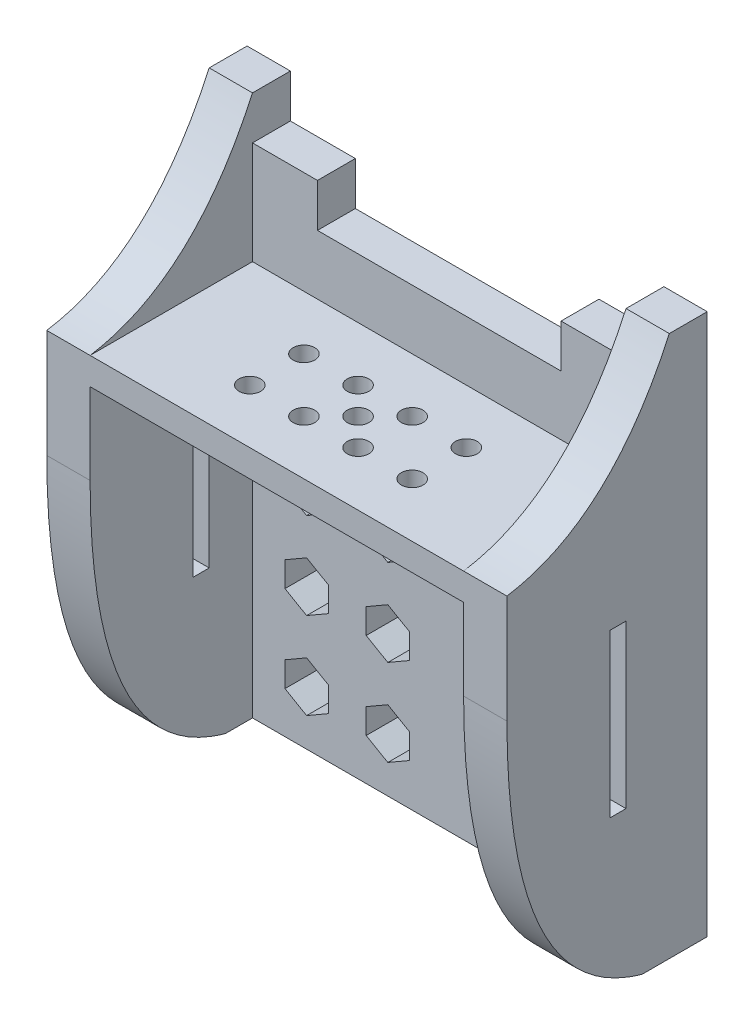
from build123d import *

# Parameters (mm, degrees)
SALIENTE_EXTRUIR1_DEPTH = 7
SALIENTE_EXTRUIR2_DEPTH = 30
CORTAR_EXTRUIR3_REACH   = 108.292
CROQUIS3_W              = 3
CROQUIS3_H              = 30
CORTAR_EXTRUIR4_DEPTH   = 7
CROQUIS5_R              = 2
CORTAR_EXTRUIR5_DEPTH   = 5


with BuildPart() as part:
    # Croquis1 → Saliente-Extruir1 (new body)
    with BuildSketch(Plane.XY):
        Polygon((-42.5, 52), (-34.5, 52), (-34.5, 44), (-22.5, 44), (-22.5, 36), (22.5, 36), (22.5, 44), (34.5, 44), (34.5, 52), (42.5, 52), (42.5, -48), (-42.5, -48), align=None)
    extrude(amount=SALIENTE_EXTRUIR1_DEPTH)

    # Croquis2 → Saliente-Extruir2 (add)
    with BuildSketch(Plane.XY.offset(7)):
        Polygon((-42.5, 52), (-42.5, -48), (-34.5, -48), (-34.5, 20), (34.5, 20), (34.5, -48), (42.5, -48), (42.5, 52), (34.5, 52), (34.5, 25), (-34.5, 25), (-34.5, 52), align=None)
    extrude(amount=SALIENTE_EXTRUIR2_DEPTH)

    # Cortar-Extruir3: up to this face of the body (flat: up to its plane)
    cortar_extruir3_end = Plane(part.part.faces().sort_by_distance((42.5, 2, 18.5))[0])
    # Croquis3 → Cortar-Extruir3 (cut, up to the picked face)
    with BuildSketch(Plane.ZY.offset(42.5), mode=Mode.PRIVATE) as cortar_extruir3_sk1:
        with BuildLine():
            Line((37, 52), (7, 52))
            add(Edge.make_bspline(
                [(7, 52), (17.9721482, 28.003586462), (37, 25)],
                knots=[0, 0, 0, 0.777512114, 0.777512114, 0.777512114], degree=2))
            Line((37, 25), (37, 52))
        make_face()
    cortar_extruir3_tool1 = split(extrude(cortar_extruir3_sk1.sketch, amount=-CORTAR_EXTRUIR3_REACH, mode=Mode.PRIVATE), bisect_by=cortar_extruir3_end, keep=Keep.BOTH, mode=Mode.PRIVATE)
    # Croquis3 → Cortar-Extruir3 (cut, up to the picked face)
    with BuildSketch(Plane.ZY.offset(42.5), mode=Mode.PRIVATE) as cortar_extruir3_sk2:
        with BuildLine():
            Line((37, -48), (37, 5))
            add(Edge.make_bspline(
                [(37, 5), (36.935096366, -41.11468491), (12, -48)],
                knots=[0, 0, 0, 0.740176789, 0.740176789, 0.740176789], degree=2))
            Line((12, -48), (37, -48))
        make_face()
    cortar_extruir3_tool2 = split(extrude(cortar_extruir3_sk2.sketch, amount=-CORTAR_EXTRUIR3_REACH, mode=Mode.PRIVATE), bisect_by=cortar_extruir3_end, keep=Keep.BOTH, mode=Mode.PRIVATE)
    # Croquis3 → Cortar-Extruir3 (cut, up to the picked face)
    with BuildSketch(Plane.ZY.offset(42.5), mode=Mode.PRIVATE) as cortar_extruir3_sk3:
        with Locations((16.5, -5)):
            Rectangle(CROQUIS3_W, CROQUIS3_H)
    cortar_extruir3_tool3 = split(extrude(cortar_extruir3_sk3.sketch, amount=-CORTAR_EXTRUIR3_REACH, mode=Mode.PRIVATE), bisect_by=cortar_extruir3_end, keep=Keep.BOTH, mode=Mode.PRIVATE)
    add(cortar_extruir3_tool1.solids().sort_by(Axis((-42.5, 41.293865, 25.499066), (1, 0, 0)))[0], mode=Mode.SUBTRACT)
    add(cortar_extruir3_tool2.solids().sort_by(Axis((-42.5, -37.068003, 30.970324), (1, 0, 0)))[0], mode=Mode.SUBTRACT)
    add(cortar_extruir3_tool3.solids().sort_by(Axis((-42.5, -5, 16.5), (1, 0, 0)))[0], mode=Mode.SUBTRACT)

    # Croquis4 → Cortar-Extruir4 (cut)
    with BuildSketch(Plane.XY.offset(7)):
        Polygon((-13.5, 12.309401077), (-13.5, 7.690598923), (-9.5, 5.381197846), (-5.5, 7.690598923), (-5.5, 12.309401077), (-9.5, 14.618802154), align=None)
        Polygon((-24.5, -10.618802154), (-20.5, -8.309401077), (-20.5, -3.690598923), (-24.5, -1.381197846), (-28.5, -3.690598923), (-28.5, -8.309401077), align=None)
        Polygon((-24.5, 5.381197846), (-20.5, 7.690598923), (-20.5, 12.309401077), (-24.5, 14.618802154), (-28.5, 12.309401077), (-28.5, 7.690598923), align=None)
        Polygon((-24.5, -26.618802154), (-20.5, -24.309401077), (-20.5, -19.690598923), (-24.5, -17.381197846), (-28.5, -19.690598923), (-28.5, -24.309401077), align=None)
        Polygon((-24.5, -42.618802154), (-20.5, -40.309401077), (-20.5, -35.690598923), (-24.5, -33.381197846), (-28.5, -35.690598923), (-28.5, -40.309401077), align=None)
        Polygon((-9.5, -10.618802154), (-5.5, -8.309401077), (-5.5, -3.690598923), (-9.5, -1.381197846), (-13.5, -3.690598923), (-13.5, -8.309401077), align=None)
        Polygon((-9.5, -26.618802154), (-5.5, -24.309401077), (-5.5, -19.690598923), (-9.5, -17.381197846), (-13.5, -19.690598923), (-13.5, -24.309401077), align=None)
        Polygon((-9.5, -42.618802154), (-5.5, -40.309401077), (-5.5, -35.690598923), (-9.5, -33.381197846), (-13.5, -35.690598923), (-13.5, -40.309401077), align=None)
        Polygon((13.5, -40.309401077), (9.5, -42.618802154), (5.5, -40.309401077), (5.5, -35.690598923), (9.5, -33.381197846), (13.5, -35.690598923), align=None)
        Polygon((28.5, -40.309401077), (24.5, -42.618802154), (20.5, -40.309401077), (20.5, -35.690598923), (24.5, -33.381197846), (28.5, -35.690598923), align=None)
        Polygon((28.5, -24.309401077), (24.5, -26.618802154), (20.5, -24.309401077), (20.5, -19.690598923), (24.5, -17.381197846), (28.5, -19.690598923), align=None)
        Polygon((13.5, -24.309401077), (9.5, -26.618802154), (5.5, -24.309401077), (5.5, -19.690598923), (9.5, -17.381197846), (13.5, -19.690598923), align=None)
        Polygon((13.5, -8.309401077), (9.5, -10.618802154), (5.5, -8.309401077), (5.5, -3.690598923), (9.5, -1.381197846), (13.5, -3.690598923), align=None)
        Polygon((28.5, -8.309401077), (24.5, -10.618802154), (20.5, -8.309401077), (20.5, -3.690598923), (24.5, -1.381197846), (28.5, -3.690598923), align=None)
        Polygon((28.5, 7.690598923), (24.5, 5.381197846), (20.5, 7.690598923), (20.5, 12.309401077), (24.5, 14.618802154), (28.5, 12.309401077), align=None)
        Polygon((9.5, 14.618802154), (13.5, 12.309401077), (13.5, 7.690598923), (9.5, 5.381197846), (5.5, 7.690598923), (5.5, 12.309401077), align=None)
    extrude(amount=-CORTAR_EXTRUIR4_DEPTH, mode=Mode.SUBTRACT)

    # Croquis5 → Cortar-Extruir5 (cut)
    with BuildSketch(Plane(origin=(0, 25, 0), x_dir=(1, 0, 0), z_dir=(0, 1, 0))):
        with Locations(Location((0, -22, 0), (0, 0, 270))):
            Circle(CROQUIS5_R)
        with Locations(Location((5, -17, 0), (0, 0, 270))):
            Circle(CROQUIS5_R)
        with Locations(Location((5, -27, 0), (0, 0, 270))):
            Circle(CROQUIS5_R)
        with Locations(Location((-5, -27, 0), (0, 0, 180))):
            Circle(CROQUIS5_R)
        with Locations(Location((-5, -17, 0), (0, 0, 180))):
            Circle(CROQUIS5_R)
        with Locations(Location((15, -17, 0), (0, 0, 270))):
            Circle(CROQUIS5_R)
        with Locations(Location((15, -27, 0), (0, 0, 270))):
            Circle(CROQUIS5_R)
        with Locations(Location((-15, -17, 0), (0, 0, 180))):
            Circle(CROQUIS5_R)
        with Locations(Location((-15, -27, 0), (0, 0, 180))):
            Circle(CROQUIS5_R)
    extrude(amount=-CORTAR_EXTRUIR5_DEPTH, mode=Mode.SUBTRACT)


solid = part.part
